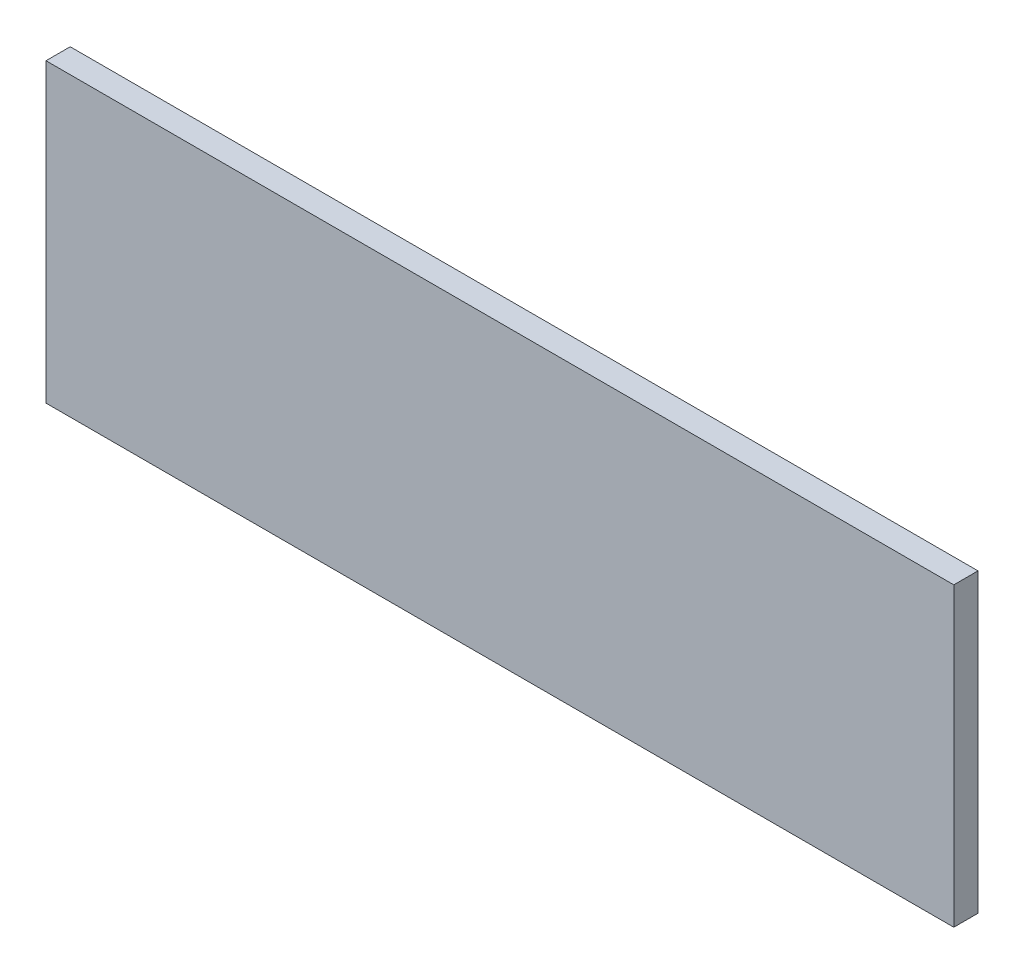
from build123d import *

# Parameters (mm, degrees)
CROQUIS1_W              = 75
CROQUIS1_H              = 24.5
SALIENTE_EXTRUIR1_DEPTH = 2


with BuildPart() as part:
    # Croquis1 → Saliente-Extruir1 (new body)
    with BuildSketch(Plane.XY):
        Rectangle(CROQUIS1_W, CROQUIS1_H)
    extrude(amount=SALIENTE_EXTRUIR1_DEPTH)


solid = part.part
